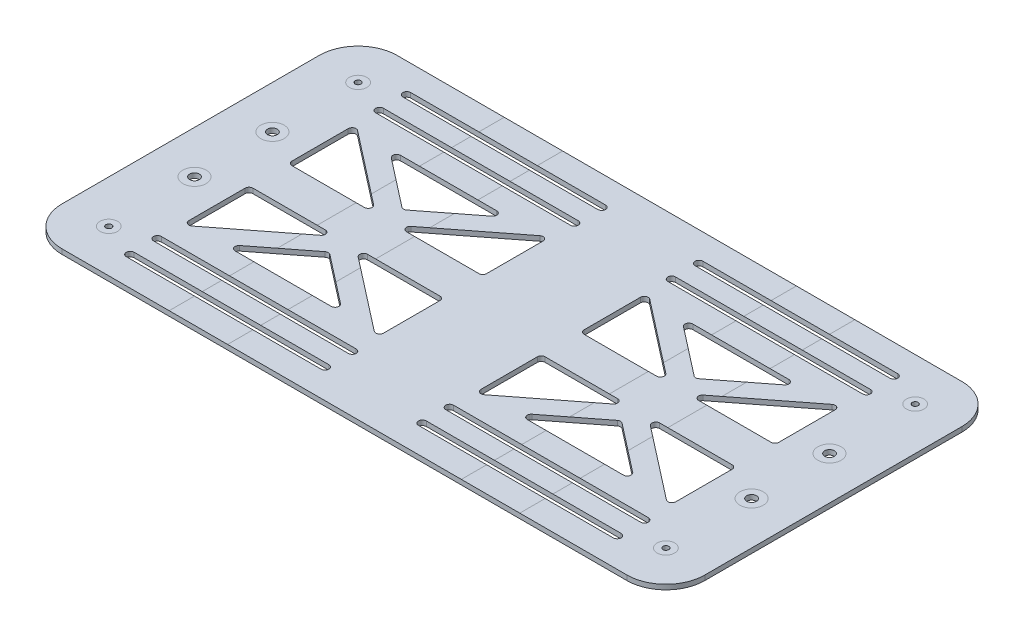
from build123d import *

# Parameters (mm, degrees)
SKETCH1_R                 = 1.5
SKETCH1_R_2               = 2.5
BATTERY_MOUNT_PLATE_DEPTH = 2.5
BATTERY_STRAP_SLOTS_DEPTH = 10
CUT_EXTRUDE1_DEPTH        = 10


with BuildPart() as part:
    # Sketch1 → battery mount plate (new body)
    with BuildSketch(Plane(origin=(0, 0, 0), x_dir=(1, 0, 0), z_dir=(0, 1, 0))):
        with BuildLine():
            Line((-145, 86), (145, 86))
            ThreePointArc((145, 86), (159.142135624, 80.142135624), (165, 66))
            Line((165, 66), (165, -66))
            ThreePointArc((165, -66), (159.142135624, -80.142135624), (145, -86))
            Line((145, -86), (-145, -86))
            ThreePointArc((-145, -86), (-159.142135624, -80.142135624), (-165, -66))
            Line((-165, -66), (-165, 66))
            ThreePointArc((-165, 66), (-159.142135624, 80.142135624), (-145, 86))
        make_face()
        with Locations((143, 64)):
            Circle(SKETCH1_R, mode=Mode.SUBTRACT)
        with Locations((-143, 64)):
            Circle(SKETCH1_R, mode=Mode.SUBTRACT)
        with Locations((143, -64)):
            Circle(SKETCH1_R, mode=Mode.SUBTRACT)
        with Locations((-143, -64)):
            Circle(SKETCH1_R, mode=Mode.SUBTRACT)
        with Locations((-143, 20)):
            Circle(SKETCH1_R_2, mode=Mode.SUBTRACT)
        with Locations((-143, -20)):
            Circle(SKETCH1_R_2, mode=Mode.SUBTRACT)
        with Locations((143, 20)):
            Circle(SKETCH1_R_2, mode=Mode.SUBTRACT)
        with Locations((143, -20)):
            Circle(SKETCH1_R_2, mode=Mode.SUBTRACT)
    extrude(amount=BATTERY_MOUNT_PLATE_DEPTH)

    # Sketch2 → battery strap slots (cut)
    with BuildSketch(Plane(origin=(0, 2.5, 0), x_dir=(1, 0, 0), z_dir=(0, 1, 0))):
        with BuildLine():
            Line((-125, 73), (-25, 73))
            ThreePointArc((-25, 73), (-23, 71), (-25, 69))
            Line((-25, 69), (-125, 69))
            ThreePointArc((-125, 69), (-127, 71), (-125, 73))
        make_face()
        with BuildLine():
            Line((25, 69), (125, 69))
            ThreePointArc((125, 69), (127, 71), (125, 73))
            Line((125, 73), (25, 73))
            ThreePointArc((25, 73), (23, 71), (25, 69))
        make_face()
        with BuildLine():
            Line((25, 55), (125, 55))
            ThreePointArc((125, 55), (127, 57), (125, 59))
            Line((125, 59), (25, 59))
            ThreePointArc((25, 59), (23, 57), (25, 55))
        make_face()
        with BuildLine():
            Line((-125, 59), (-25, 59))
            ThreePointArc((-25, 59), (-23, 57), (-25, 55))
            Line((-25, 55), (-125, 55))
            ThreePointArc((-125, 55), (-127, 57), (-125, 59))
        make_face()
        with BuildLine():
            Line((-125, -55), (-25, -55))
            ThreePointArc((-25, -55), (-23, -57), (-25, -59))
            Line((-25, -59), (-125, -59))
            ThreePointArc((-125, -59), (-127, -57), (-125, -55))
        make_face()
        with BuildLine():
            Line((25, -59), (125, -59))
            ThreePointArc((125, -59), (127, -57), (125, -55))
            Line((125, -55), (25, -55))
            ThreePointArc((25, -55), (23, -57), (25, -59))
        make_face()
        with BuildLine():
            Line((25, -73), (125, -73))
            ThreePointArc((125, -73), (127, -71), (125, -69))
            Line((125, -69), (25, -69))
            ThreePointArc((25, -69), (23, -71), (25, -73))
        make_face()
        with BuildLine():
            Line((-125, -69), (-25, -69))
            ThreePointArc((-25, -69), (-23, -71), (-25, -73))
            Line((-25, -73), (-125, -73))
            ThreePointArc((-125, -73), (-127, -71), (-125, -69))
        make_face()
    extrude(amount=-BATTERY_STRAP_SLOTS_DEPTH, mode=Mode.SUBTRACT)

    # Sketch3 → Cut-Extrude1 (cut)
    with BuildSketch(Plane(origin=(0, 2.5, 0), x_dir=(1, 0, 0), z_dir=(0, 1, 0))):
        with BuildLine():
            Line((-125, 40.910721278), (-125, 12))
            ThreePointArc((-125, 12), (-124.414213562, 10.585786438), (-123, 10))
            Line((-123, 10), (-85.829072643, 10))
            ThreePointArc((-85.829072643, 10), (-83.937326245, 11.35092715), (-84.601191416, 13.578704435))
            Line((-84.601191416, 13.578704435), (-121.772118773, 42.489425712))
            ThreePointArc((-121.772118773, 42.489425712), (-123.878702892, 42.707351798), (-125, 40.910721278))
        make_face()
        with BuildLine():
            Line((-84.601191416, -13.578704435), (-121.772118773, -42.489425712))
            ThreePointArc((-121.772118773, -42.489425712), (-123.878702892, -42.707351798), (-125, -40.910721278))
            Line((-125, -40.910721278), (-125, -12))
            ThreePointArc((-125, -12), (-124.414213562, -10.585786438), (-123, -10))
            Line((-123, -10), (-85.829072643, -10))
            ThreePointArc((-85.829072643, -10), (-83.937326245, -11.35092715), (-84.601191416, -13.578704435))
        make_face()
        with BuildLine():
            Line((-25, -40.910721278), (-25, -12))
            ThreePointArc((-25, -12), (-25.585786438, -10.585786438), (-27, -10))
            Line((-27, -10), (-64.170927357, -10))
            ThreePointArc((-64.170927357, -10), (-66.062673755, -11.35092715), (-65.398808584, -13.578704435))
            Line((-65.398808584, -13.578704435), (-28.227881227, -42.489425712))
            ThreePointArc((-28.227881227, -42.489425712), (-26.121297108, -42.707351798), (-25, -40.910721278))
        make_face()
        with BuildLine():
            Line((-65.398808584, 13.578704435), (-28.227881227, 42.489425712))
            ThreePointArc((-28.227881227, 42.489425712), (-26.121297108, 42.707351798), (-25, 40.910721278))
            Line((-25, 40.910721278), (-25, 12))
            ThreePointArc((-25, 12), (-25.585786438, 10.585786438), (-27, 10))
            Line((-27, 10), (-64.170927357, 10))
            ThreePointArc((-64.170927357, 10), (-66.062673755, 11.35092715), (-65.398808584, 13.578704435))
        make_face()
        with BuildLine():
            Line((-99.654825771, 42.489425712), (-50.345174229, 42.489425712))
            ThreePointArc((-50.345174229, 42.489425712), (-48.453427831, 41.138498563), (-49.117293002, 38.910721278))
            Line((-49.117293002, 38.910721278), (-73.772118773, 19.734745678))
            ThreePointArc((-73.772118773, 19.734745678), (-75, 19.313450112), (-76.227881227, 19.734745678))
            Line((-76.227881227, 19.734745678), (-100.882706998, 38.910721278))
            ThreePointArc((-100.882706998, 38.910721278), (-101.546572169, 41.138498563), (-99.654825771, 42.489425712))
        make_face()
        with BuildLine():
            Line((-49.117293002, -38.910721278), (-73.772118773, -19.734745678))
            ThreePointArc((-73.772118773, -19.734745678), (-75, -19.313450112), (-76.227881227, -19.734745678))
            Line((-76.227881227, -19.734745678), (-100.882706998, -38.910721278))
            ThreePointArc((-100.882706998, -38.910721278), (-101.546572169, -41.138498563), (-99.654825771, -42.489425712))
            Line((-99.654825771, -42.489425712), (-50.345174229, -42.489425712))
            ThreePointArc((-50.345174229, -42.489425712), (-48.453427831, -41.138498563), (-49.117293002, -38.910721278))
        make_face()
        with BuildLine():
            Line((76.227881227, -19.734745678), (100.882706998, -38.910721278))
            ThreePointArc((100.882706998, -38.910721278), (101.546572169, -41.138498563), (99.654825771, -42.489425712))
            Line((99.654825771, -42.489425712), (50.345174229, -42.489425712))
            ThreePointArc((50.345174229, -42.489425712), (48.453427831, -41.138498563), (49.117293002, -38.910721278))
            Line((49.117293002, -38.910721278), (73.772118773, -19.734745678))
            ThreePointArc((73.772118773, -19.734745678), (75, -19.313450112), (76.227881227, -19.734745678))
        make_face()
        with BuildLine():
            Line((76.227881227, 19.734745678), (100.882706998, 38.910721278))
            ThreePointArc((100.882706998, 38.910721278), (101.546572169, 41.138498563), (99.654825771, 42.489425712))
            Line((99.654825771, 42.489425712), (50.345174229, 42.489425712))
            ThreePointArc((50.345174229, 42.489425712), (48.453427831, 41.138498563), (49.117293002, 38.910721278))
            Line((49.117293002, 38.910721278), (73.772118773, 19.734745678))
            ThreePointArc((73.772118773, 19.734745678), (75, 19.313450112), (76.227881227, 19.734745678))
        make_face()
        with BuildLine():
            Line((25, 40.910721278), (25, 12))
            ThreePointArc((25, 12), (25.585786438, 10.585786438), (27, 10))
            Line((27, 10), (64.170927357, 10))
            ThreePointArc((64.170927357, 10), (66.062673755, 11.35092715), (65.398808584, 13.578704435))
            Line((65.398808584, 13.578704435), (28.227881227, 42.489425712))
            ThreePointArc((28.227881227, 42.489425712), (26.121297108, 42.707351798), (25, 40.910721278))
        make_face()
        with BuildLine():
            Line((65.398808584, -13.578704435), (28.227881227, -42.489425712))
            ThreePointArc((28.227881227, -42.489425712), (26.121297108, -42.707351798), (25, -40.910721278))
            Line((25, -40.910721278), (25, -12))
            ThreePointArc((25, -12), (25.585786438, -10.585786438), (27, -10))
            Line((27, -10), (64.170927357, -10))
            ThreePointArc((64.170927357, -10), (66.062673755, -11.35092715), (65.398808584, -13.578704435))
        make_face()
        with BuildLine():
            Line((125, -40.910721278), (125, -12))
            ThreePointArc((125, -12), (124.414213562, -10.585786438), (123, -10))
            Line((123, -10), (85.829072643, -10))
            ThreePointArc((85.829072643, -10), (83.937326245, -11.35092715), (84.601191416, -13.578704435))
            Line((84.601191416, -13.578704435), (121.772118773, -42.489425712))
            ThreePointArc((121.772118773, -42.489425712), (123.878702892, -42.707351798), (125, -40.910721278))
        make_face()
        with BuildLine():
            Line((84.601191416, 13.578704435), (121.772118773, 42.489425712))
            ThreePointArc((121.772118773, 42.489425712), (123.878702892, 42.707351798), (125, 40.910721278))
            Line((125, 40.910721278), (125, 12))
            ThreePointArc((125, 12), (124.414213562, 10.585786438), (123, 10))
            Line((123, 10), (85.829072643, 10))
            ThreePointArc((85.829072643, 10), (83.937326245, 11.35092715), (84.601191416, 13.578704435))
        make_face()
    extrude(amount=-CUT_EXTRUDE1_DEPTH, mode=Mode.SUBTRACT)


solid = part.part
